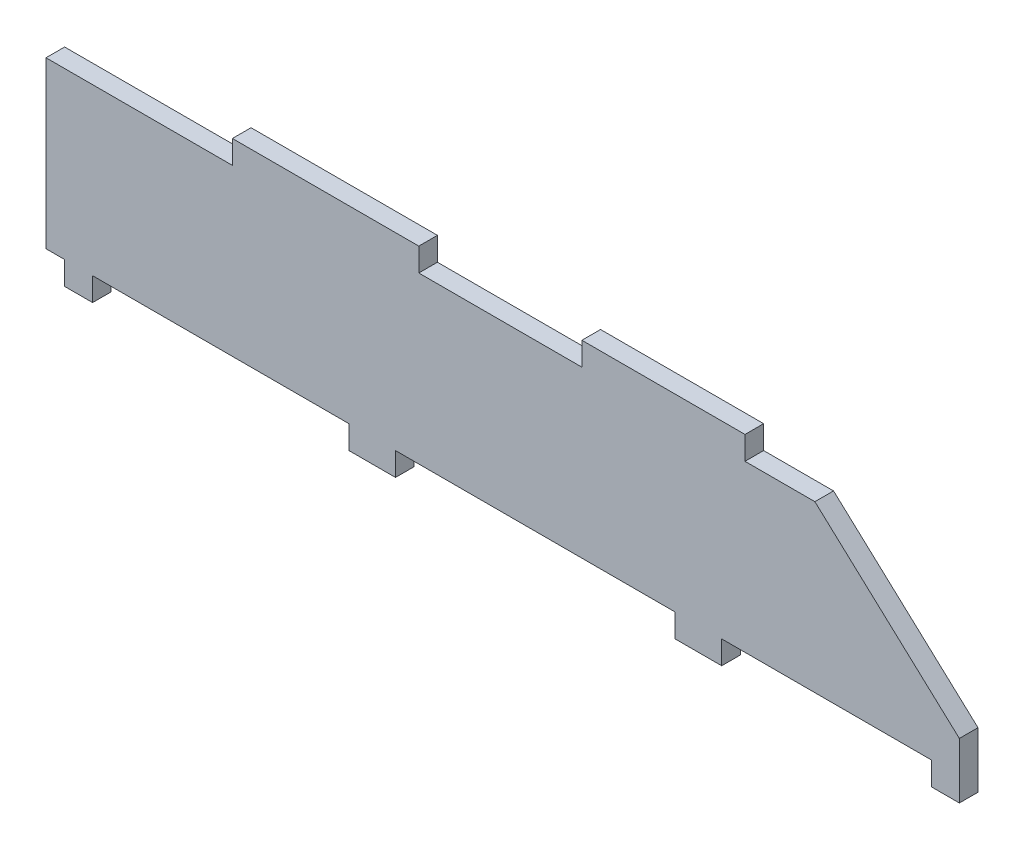
from build123d import *

# Parameters (mm, degrees)
BOSS_EXTRUDE1_DEPTH = 4


with BuildPart() as part:
    # Sketch1 → Boss-Extrude1 (new body)
    with BuildSketch(Plane.XY):
        Polygon((0, 0), (35, 0), (35, -5), (45, -5), (45, 0), (90, 0), (90, -5), (96, -5), (96, 0), (96, 7), (65, 35.5), (50, 35.5), (50, 40.5), (15, 40.5), (15, 35.5), (-20, 35.5), (-20, 40.5), (-60, 40.5), (-60, 35.5), (-100, 35.5), (-100, 0), (-96, 0), (-96, -5), (-90, -5), (-90, 0), (-35, 0), (-35, -5), (-25, -5), (-25, 0), align=None)
    extrude(amount=BOSS_EXTRUDE1_DEPTH)


solid = part.part
